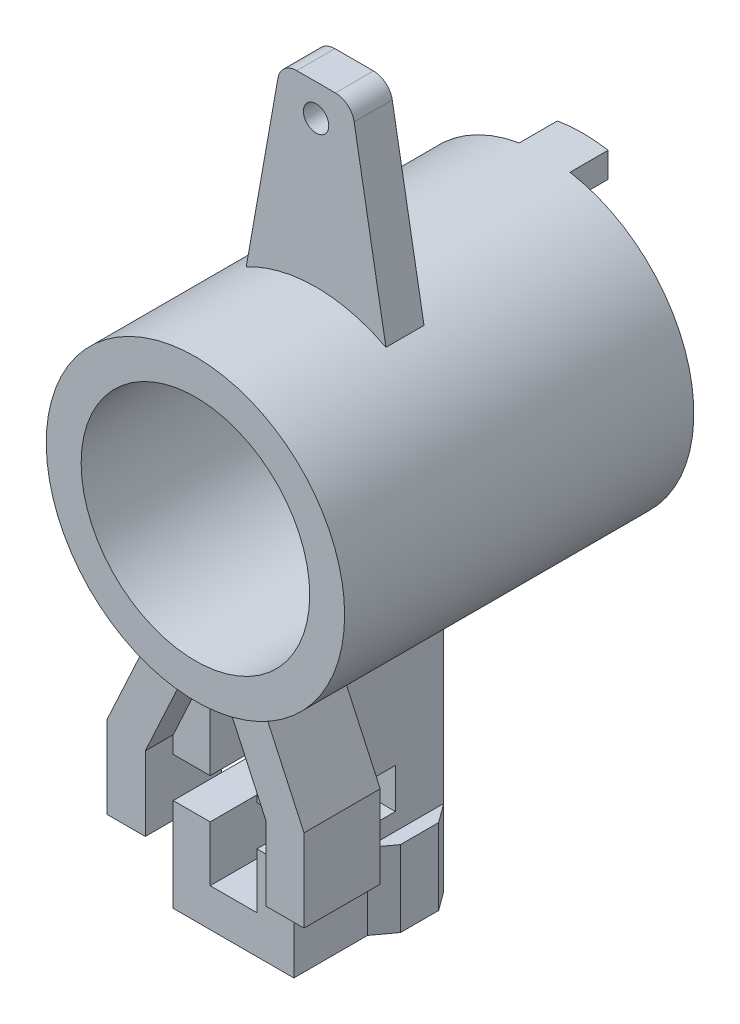
from build123d import *

# Parameters (mm, degrees)
SKETCH1_R           = 5.969
SKETCH1_R_2         = 4.572
BASE_EXTRUDE_DEPTH  = 13.97
BOSS_EXTRUDE1_START = -7.112
BOSS_EXTRUDE1_DEPTH = 7.112
SKETCH3_W           = 4.826
SKETCH3_H           = 3.048
CUT_EXTRUDE1_DEPTH  = 1.524
CUT_EXTRUDE2_START  = -6.605477
SKETCH4_W           = 1.524
SKETCH4_H           = 4.064
CUT_EXTRUDE2_DEPTH  = 6.605477
CUT_EXTRUDE3_REACH  = 24.222
SKETCH5_R           = 0.8001
BOSS_EXTRUDE2_START = -1.524
BOSS_EXTRUDE2_DEPTH = 1.524
SKETCH7_R           = 0.508
CUT_EXTRUDE4_DEPTH  = 19.64522636
BOSS_EXTRUDE3_START = 1.524
BOSS_EXTRUDE3_DEPTH = 1.524
BOSS_EXTRUDE4_START = -3.048
BOSS_EXTRUDE4_DEPTH = 3.048
CUT_EXTRUDE5_START  = -1.1176
CUT_EXTRUDE5_DEPTH  = 1.1176
CUT_EXTRUDE6_START  = -4.064
CUT_EXTRUDE6_DEPTH  = 4.064


with BuildPart() as part:
    # Sketch1 → Base-Extrude (new body)
    with BuildSketch(Plane.XY):
        Circle(SKETCH1_R)
        Circle(SKETCH1_R_2, mode=Mode.SUBTRACT)
    extrude(amount=BASE_EXTRUDE_DEPTH)

    # Sketch2 → Boss-Extrude1 (add)
    with BuildSketch(Plane.XY.offset(13.5636).offset(BOSS_EXTRUDE1_START)):
        with BuildLine():
            Line((-2.413, -5.459523056), (-3.937, -8.763))
            Line((-3.937, -8.763), (-3.937, -12.065))
            Line((-3.937, -12.065), (-2.413, -12.065))
            Line((-2.413, -12.065), (-2.413, -15.113))
            Line((-2.413, -15.113), (2.413, -15.113))
            Line((2.413, -15.113), (2.413, -12.065))
            Line((2.413, -12.065), (3.937, -12.065))
            Line((3.937, -12.065), (3.937, -8.763))
            Line((3.937, -8.763), (2.413, -5.459523056))
            ThreePointArc((2.413, -5.459523056), (0, -5.969), (-2.413, -5.459523056))
        make_face()
    extrude(amount=BOSS_EXTRUDE1_DEPTH)

    # Sketch3 → Cut-Extrude1 (cut)
    with BuildSketch(Plane.XY.offset(13.97)):
        with Locations((0, -13.589)):
            Rectangle(SKETCH3_W, SKETCH3_H)
    extrude(amount=-CUT_EXTRUDE1_DEPTH, mode=Mode.SUBTRACT)

    # Sketch4 → Cut-Extrude2 (cut)
    with BuildSketch(Plane.XZ.offset(12.065).offset(CUT_EXTRUDE2_START)):
        with Locations((3.175, 8.4836)):
            Rectangle(SKETCH4_W, SKETCH4_H)
        with Locations((-3.175, 8.4836)):
            Rectangle(SKETCH4_W, SKETCH4_H)
    extrude(amount=CUT_EXTRUDE2_DEPTH, mode=Mode.SUBTRACT)

    # Sketch5 → Cut-Extrude3 (cut, up to next)
    with BuildSketch(Plane(origin=(2.413, 0, 0), x_dir=(0, 0, -1), z_dir=(1, 0, 0)), mode=Mode.PRIVATE) as cut_extrude3_sk1:
        with Locations(Location((-9.7155, -10.577465123, 0), (0, 0, 180))):
            Circle(SKETCH5_R)
    cut_extrude3_tool1 = extrude(cut_extrude3_sk1.sketch, amount=-CUT_EXTRUDE3_REACH, mode=Mode.PRIVATE) & part.part
    add(cut_extrude3_tool1.solids().sort_by_distance((2.413, -10.577465, 9.7155))[0], mode=Mode.SUBTRACT)

    # Sketch6 → Boss-Extrude2 (add)
    with BuildSketch(Plane.XY.offset(9.144).offset(BOSS_EXTRUDE2_START)):
        with BuildLine():
            Line((-2.794, 5.274706153), (-1.524, 12.451775059))
            ThreePointArc((-1.524, 12.451775059), (-1.263283995, 12.902874385), (-0.773656889, 13.081))
            Line((-0.773656889, 13.081), (0.773656889, 13.081))
            ThreePointArc((0.773656889, 13.081), (1.263283995, 12.902874385), (1.524, 12.451775059))
            Line((1.524, 12.451775059), (2.794, 5.274706153))
            ThreePointArc((2.794, 5.274706153), (0, 5.969), (-2.794, 5.274706153))
        make_face()
    extrude(amount=BOSS_EXTRUDE2_DEPTH)

    # Sketch7 → Cut-Extrude4 (cut, through all)
    with BuildSketch(Plane.XY.offset(9.144)):
        with Locations((0, 11.811)):
            Circle(SKETCH7_R)
    extrude(amount=-CUT_EXTRUDE4_DEPTH, mode=Mode.SUBTRACT)

    # Sketch8 → Boss-Extrude3 (add)
    with BuildSketch(Plane(origin=(0, 0, 0), x_dir=(-1, 0, 0), z_dir=(0, 0, -1)).offset(BOSS_EXTRUDE3_START)):
        with BuildLine():
            Line((-1.016, 4.873623966), (-1.016, 5.881896378))
            ThreePointArc((-1.016, 5.881896378), (0, 5.969), (1.016, 5.881896378))
            Line((1.016, 5.881896378), (1.016, 4.873623966))
            ThreePointArc((1.016, 4.873623966), (0, 4.9784), (-1.016, 4.873623966))
        make_face()
    extrude(amount=-BOSS_EXTRUDE3_DEPTH)

    # Sketch9 → Boss-Extrude4 (add)
    with BuildSketch(Plane.XZ.offset(15.113).offset(BOSS_EXTRUDE4_START)):
        Polygon((2.413, 9.4996), (2.9718, 8.7376), (2.9718, 7.2136), (2.413, 6.4516), align=None)
        Polygon((-2.413, 9.4996), (-2.9718, 8.7376), (-2.9718, 7.2136), (-2.413, 6.4516), align=None)
    extrude(amount=BOSS_EXTRUDE4_DEPTH)

    # Sketch10 → Cut-Extrude5 (cut)
    with BuildSketch(Plane.XY.offset(13.5636).offset(CUT_EXTRUDE5_START)):
        with BuildLine():
            Line((-2.413, -12.065), (2.413, -12.065))
            Line((2.413, -12.065), (2.413, -9.097590664))
            Line((2.413, -9.097590664), (0.935640411, -5.895213145))
            ThreePointArc((0.935640411, -5.895213145), (0, -5.969), (-0.935640411, -5.895213145))
            Line((-0.935640411, -5.895213145), (-2.413, -9.097590664))
            Line((-2.413, -9.097590664), (-2.413, -12.065))
        make_face()
    extrude(amount=CUT_EXTRUDE5_DEPTH, mode=Mode.SUBTRACT)

    # Sketch12 → Cut-Extrude6 (cut)
    with BuildSketch(Plane.XY.offset(12.446).offset(CUT_EXTRUDE6_START)):
        with BuildLine():
            Line((0.935640411, -5.895213145), (0.935640411, -9.777365123))
            Line((0.935640411, -9.777365123), (2.413, -9.777365123))
            Line((2.413, -9.777365123), (2.413, -11.377565123))
            Line((2.413, -11.377565123), (0.935640411, -11.377565123))
            Line((0.935640411, -11.377565123), (0.935640411, -13.589))
            Line((0.935640411, -13.589), (-0.935640411, -13.589))
            Line((-0.935640411, -13.589), (-0.935640411, -11.377565123))
            Line((-0.935640411, -11.377565123), (-2.413, -11.377565123))
            Line((-2.413, -11.377565123), (-2.413, -9.777365123))
            Line((-2.413, -9.777365123), (-0.935640411, -9.777365123))
            Line((-0.935640411, -9.777365123), (-0.935640411, -5.895213145))
            ThreePointArc((-0.935640411, -5.895213145), (0, -5.969), (0.935640411, -5.895213145))
        make_face()
    extrude(amount=CUT_EXTRUDE6_DEPTH, mode=Mode.SUBTRACT)


solid = part.part
